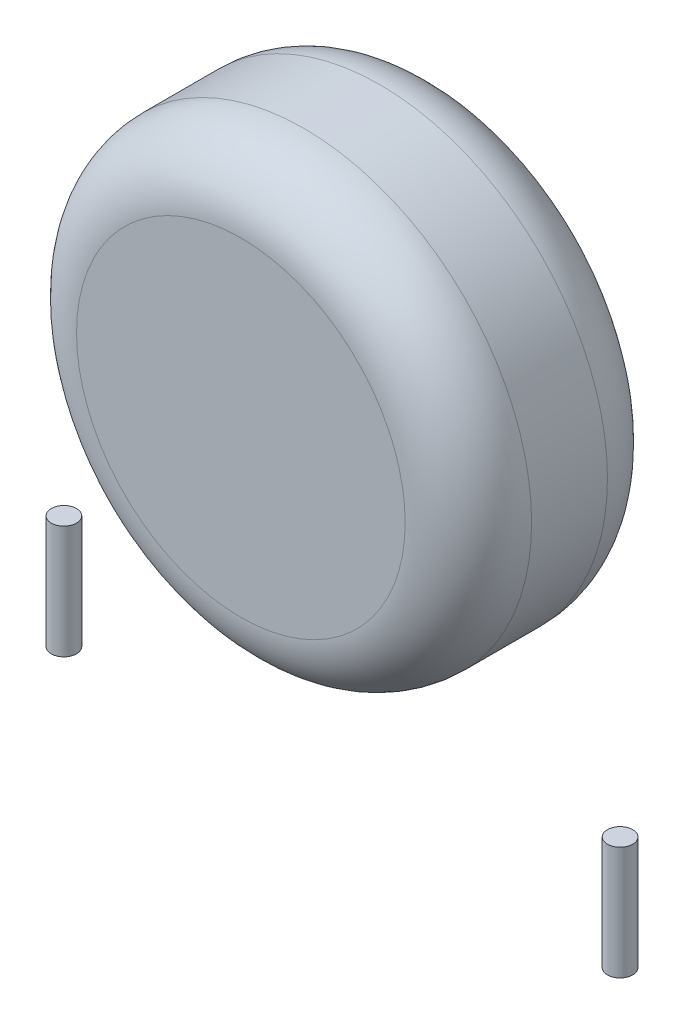
from build123d import *

# Parameters (mm, degrees)
EXTRUDE_1_DEPTH      = 4
EXTRUDE_1_DEPTH_BACK = 4
SKETCH_1_R           = 9
SKETCH_3_R           = 0.5
EXTRUDE_2_DEPTH      = 4.48
EXTRUDE_2_2_DEPTH    = 4.48
FILLET_1_R           = 2.5


with BuildPart() as part:
    # Эскиз1 → Вытянуть1 (new, two sides: drawn at the far end of the back side and taken through both)
    with BuildSketch(Plane.XY.offset(-EXTRUDE_1_DEPTH_BACK)):
        with Locations((0, 15)):
            Circle(SKETCH_1_R)
    extrude(amount=EXTRUDE_1_DEPTH + EXTRUDE_1_DEPTH_BACK)

    # Скругление1
    fillet_1_edges = [part.edges().sort_by_distance(p)[0] for p in [
        (-9, 15, -4),
        (-9, 15, 4),
    ]]
    fillet(fillet_1_edges, radius=FILLET_1_R)


with BuildPart() as body_2:
    # Эскиз3 → Вытянуть2 (new body)
    with BuildSketch(Plane(origin=(0, 0, 0), x_dir=(1, 0, 0), z_dir=(0, 1, 0))):
        with Locations((-11, 0)):
            Circle(SKETCH_3_R)
    extrude(amount=EXTRUDE_2_DEPTH)


with BuildPart() as body_3:
    # Эскиз3 → Extrude 2 2 (new body)
    with BuildSketch(Plane(origin=(0, 0, 0), x_dir=(1, 0, 0), z_dir=(0, 1, 0))):
        with Locations((11, 0)):
            Circle(SKETCH_3_R)
    extrude(amount=EXTRUDE_2_2_DEPTH)


solid = Compound([part.part, body_2.part, body_3.part])
